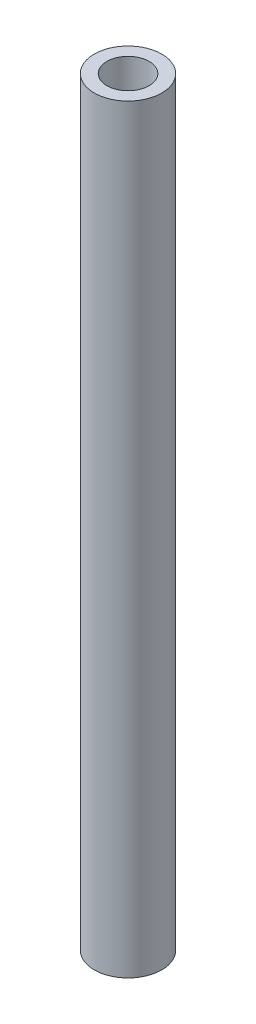
from build123d import *

# Parameters (mm, degrees)
SZKIC1_R                    = 4
SZKIC1_R_2                  = 2.5
DODANIE_WYCI_GNI_CIE1_DEPTH = 90


with BuildPart() as part:
    # Szkic1 → Dodanie-wyciągnięcie1 (new body)
    with BuildSketch(Plane(origin=(0, 0, 0), x_dir=(1, 0, 0), z_dir=(0, 1, 0))):
        with Locations(Location((0, 0, 0), (0, 0, 90))):
            Circle(SZKIC1_R)
        with Locations(Location((0, 0, 0), (0, 0, 90))):
            Circle(SZKIC1_R_2, mode=Mode.SUBTRACT)
    extrude(amount=DODANIE_WYCI_GNI_CIE1_DEPTH)


solid = part.part
